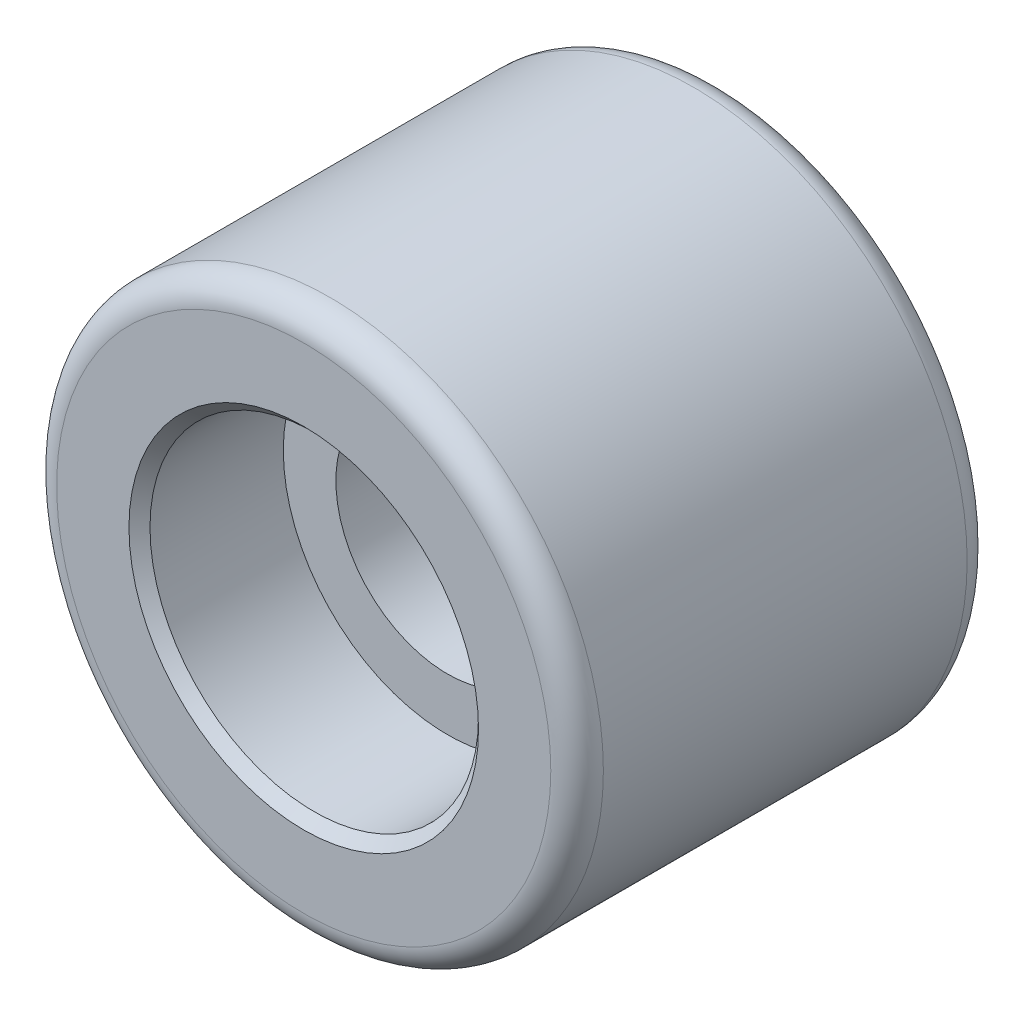
from build123d import *

# Parameters (mm, degrees)
SKETCH1_R           = 16.51
SKETCH1_R_2         = 4.7625
BOSS_EXTRUDE1_DEPTH = 25.146
FILLET2_R           = 1.5875


with BuildPart() as part:
    # Sketch1 → Boss-Extrude1 (new body)
    with BuildSketch(Plane.XY):
        with Locations((-66.414856712, -15.92976268)):
            Circle(SKETCH1_R)
        with Locations((-66.414856712, -15.92976268)):
            Circle(SKETCH1_R_2, mode=Mode.SUBTRACT)
    extrude(amount=BOSS_EXTRUDE1_DEPTH)

    # Fillet2
    fillet2_edges = [part.edges().sort_by_distance(p)[0] for p in [
        (-82.924856712, -15.92976268, 0),
        (-82.924856712, -15.92976268, 25.146),
    ]]
    fillet(fillet2_edges, radius=FILLET2_R)

    # Sketch4 → CBORE for 1/2 Socket Shoulder Screw1 (revolve, cut)
    with BuildSketch(Plane(origin=(-66.414856712, -15.92976268, 25.146), x_dir=(0, -1, 0), z_dir=(1, 0, 0))):
        Polygon((0, 0), (0, 25.146), (6.74624, 25.146), (6.74624, 8.6868), (9.92124, 8.6868), (9.92124, 0.635), (10.55624, 0), align=None)
    revolve(axis=Axis((-66.414856712, -15.92976268, 31.496), (0, 0, -1)), mode=Mode.SUBTRACT)


solid = part.part
